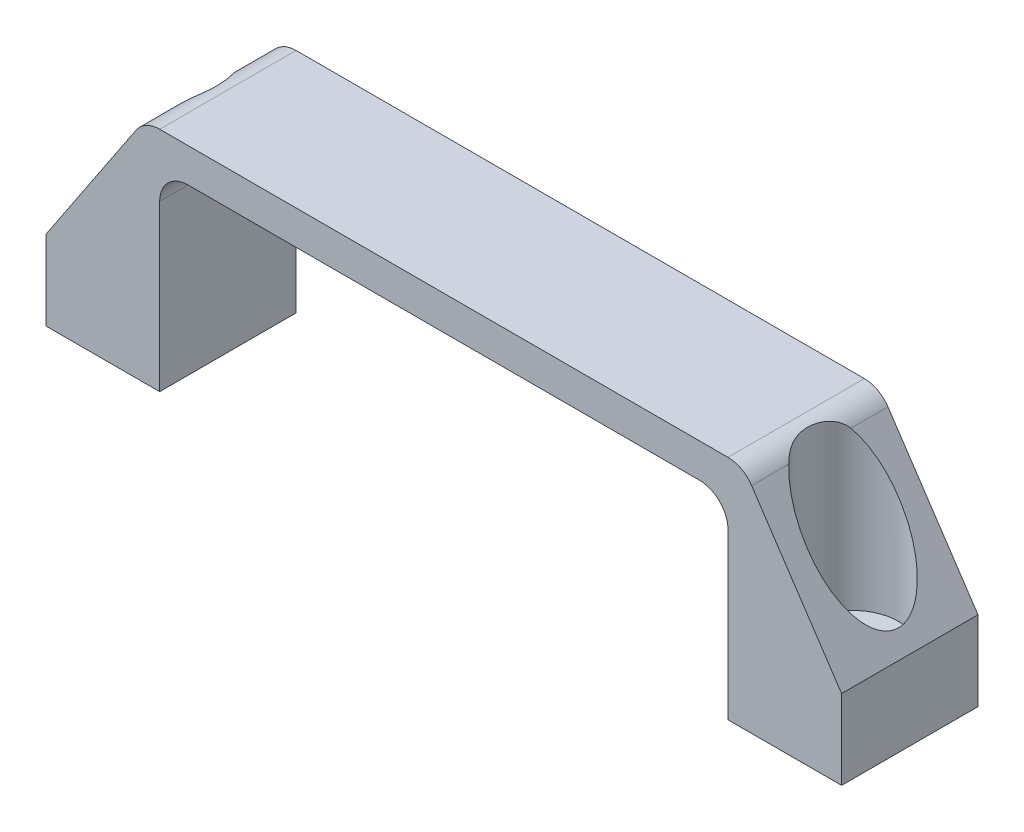
from build123d import *

# Parameters (mm, degrees)
EXTRUDE_1_DEPTH          = 24
CUT_EXTRUDE_1_DEPTH      = 148.566933966
CUT_EXTRUDE_1_DEPTH_BACK = 20
SKETCH_2_R               = 4.5
CUT_EXTRUDE_2_DEPTH      = 10
CUT_EXTRUDE_2_DEPTH_BACK = 24
SKETCH_3_R               = 8


with BuildPart() as part:
    # 草图1 → 凸台-拉伸1 (new body)
    with BuildSketch(Plane.XY):
        with BuildLine():
            Line((0, 0), (0, 14))
            Line((0, 14), (15.83900126, 37.772379752))
            ThreePointArc((15.83900126, 37.772379752), (17.640116397, 39.408055056), (20, 40))
            Line((20, 40), (120, 40))
            ThreePointArc((120, 40), (122.359883603, 39.408055056), (124.16099874, 37.772379752))
            Line((124.16099874, 37.772379752), (140, 14))
            Line((140, 14), (140, 0))
            Line((140, 0), (120, 0))
            Line((120, 0), (120, 29))
            ThreePointArc((120, 29), (118.535533906, 32.535533906), (115, 34))
            Line((115, 34), (25, 34))
            ThreePointArc((25, 34), (21.464466094, 32.535533906), (20, 29))
            Line((20, 29), (20, 0))
            Line((20, 0), (0, 0))
        make_face()
    extrude(amount=-EXTRUDE_1_DEPTH)

    # 草图2 → 切除-拉伸1 (cut, two sides: drawn at the far end of the back side and taken through both)
    with BuildSketch(Plane.XZ.offset(-CUT_EXTRUDE_1_DEPTH_BACK)):
        with Locations(Location((10, -12, 0), (0, 0, 180))):
            Circle(SKETCH_2_R)
        with Locations(Location((130, -12, 0), (0, 0, 180))):
            Circle(SKETCH_2_R)
    extrude(amount=CUT_EXTRUDE_1_DEPTH + CUT_EXTRUDE_1_DEPTH_BACK, mode=Mode.SUBTRACT)

    # 草图3 → 切除-拉伸2 (cut, two sides: drawn at the far end of the back side and taken through both)
    with BuildSketch(Plane.XZ.offset(-20).offset(-CUT_EXTRUDE_2_DEPTH_BACK)):
        with Locations(Location((130, -12, 0), (0, 0, 223.124062677))):
            Circle(SKETCH_3_R)
        with Locations(Location((10, -12, 0), (0, 0, 316.875929093))):
            Circle(SKETCH_3_R)
    extrude(amount=CUT_EXTRUDE_2_DEPTH + CUT_EXTRUDE_2_DEPTH_BACK, mode=Mode.SUBTRACT)


solid = part.part
